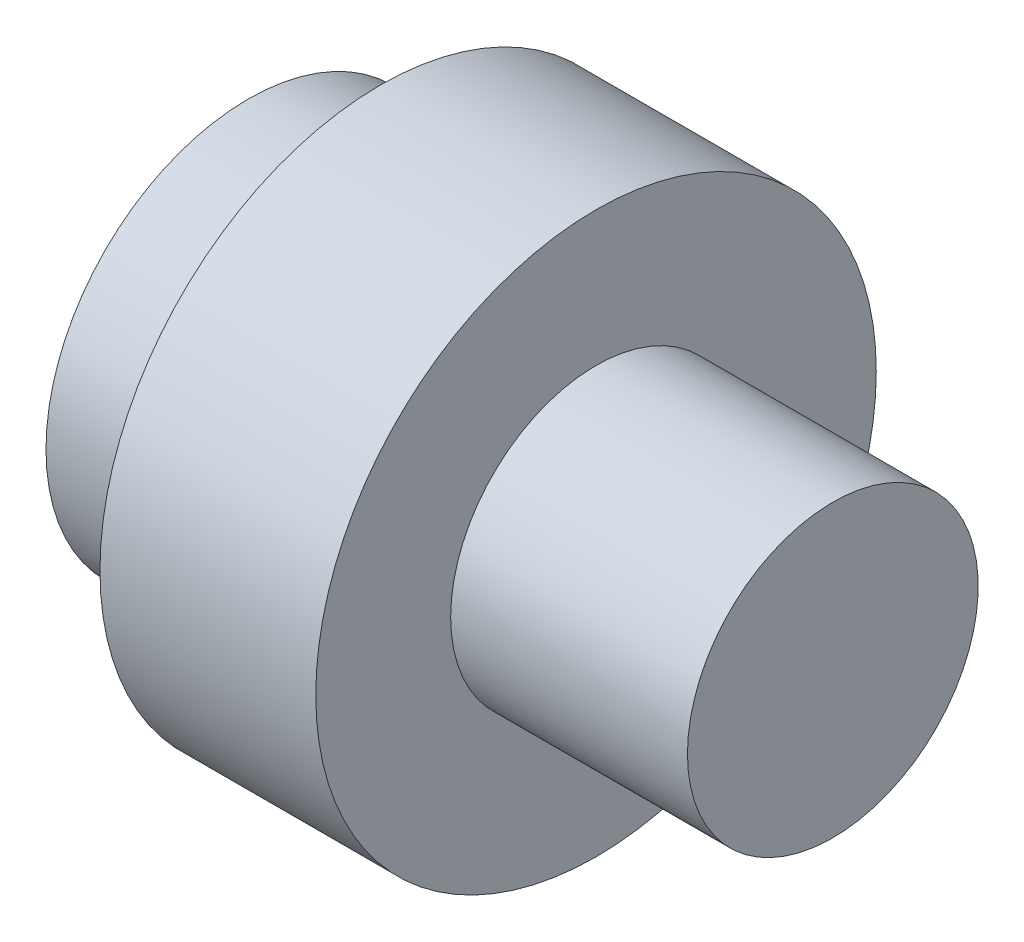
from build123d import *


with BuildPart() as part:
    # 스케치1 → 회전1 (revolve)
    with BuildSketch(Plane.XY, mode=Mode.PRIVATE) as revolve_1_sk:
        Polygon((0, 0), (0, 18.08007909), (11.785533037, 18.08007909), (11.785533037, 25.044257703), (31.070950733, 25.044257703), (31.070950733, 12.990871643), (52.231339595, 12.990871643), (52.231339595, 0), align=None)
    revolve(revolve_1_sk.sketch.rotate(Axis((0, 0, 0), (1, 0, 0)), 90), axis=Axis((0, 0, 0), (1, 0, 0)))


solid = part.part
